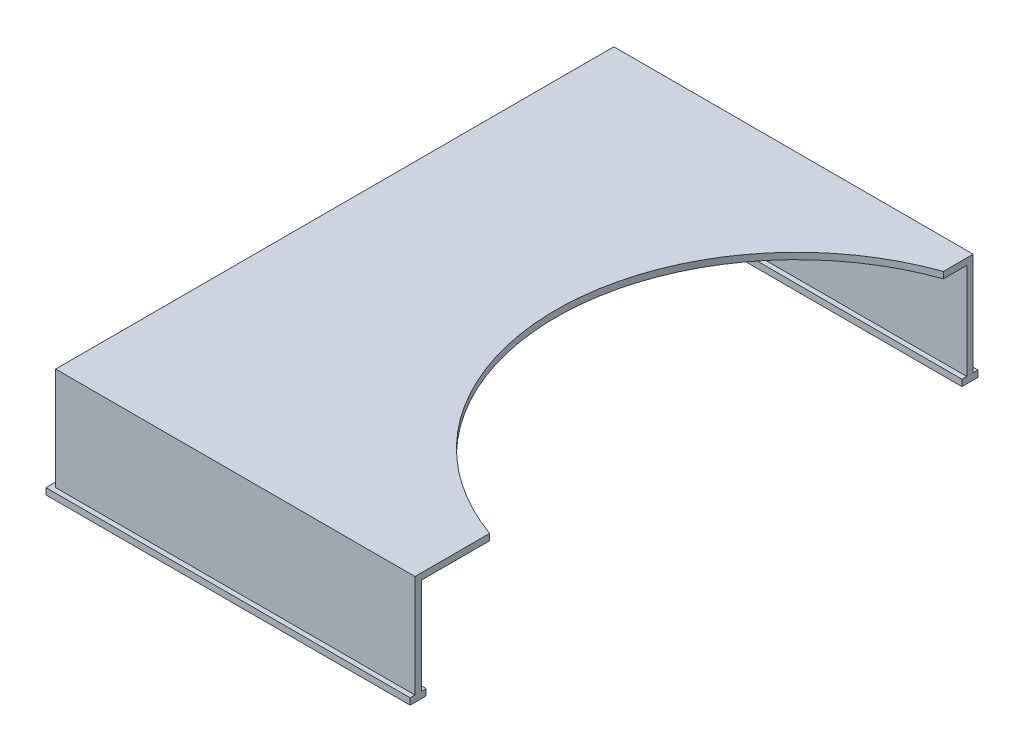
from build123d import *

# Parameters (mm, degrees)
SKETCH_1_W          = 224
SKETCH_1_H          = 174
SKETCH_1_W_2        = 220
SKETCH_1_H_2        = 170
EXTRUDE_1_DEPTH     = 32
SKETCH_2_W          = 227
SKETCH_2_H          = 177
SKETCH_2_W_2        = 217
SKETCH_2_H_2        = 167
EXTRUDE_2_DEPTH     = 2
SKETCH_3_W          = 222
SKETCH_3_H          = 172
SKETCH_3_R          = 75
EXTRUDE_3_DEPTH     = 2
SKETCH_4_W          = 113.5
SKETCH_4_H          = 177
CUT_EXTRUDE_1_DEPTH = 285.974560268


with BuildPart() as part:
    # 草图1 → 凸台-拉伸1 (new body)
    with BuildSketch(Plane(origin=(0, 0, 0), x_dir=(1, 0, 0), z_dir=(0, 1, 0))):
        with Locations((110, -85)):
            Rectangle(SKETCH_1_W, SKETCH_1_H)
        with Locations((110, -85)):
            Rectangle(SKETCH_1_W_2, SKETCH_1_H_2, mode=Mode.SUBTRACT)
    extrude(amount=EXTRUDE_1_DEPTH)

    # 草图2 → 凸台-拉伸2 (add)
    with BuildSketch(Plane(origin=(0, 0, 0), x_dir=(1, 0, 0), z_dir=(0, 1, 0))):
        with Locations((110, -85)):
            Rectangle(SKETCH_2_W, SKETCH_2_H)
        with Locations((110, -85)):
            Rectangle(SKETCH_2_W_2, SKETCH_2_H_2, mode=Mode.SUBTRACT)
    extrude(amount=-EXTRUDE_2_DEPTH)

    # 草图3 → 凸台-拉伸3 (add)
    with BuildSketch(Plane(origin=(0, 32, 0), x_dir=(1, 0, 0), z_dir=(0, 1, 0))):
        with Locations((109, -84)):
            Rectangle(SKETCH_3_W, SKETCH_3_H)
        with Locations(Location((135, -78, 0), (0, 0, 270))):
            Circle(SKETCH_3_R, mode=Mode.SUBTRACT)
    extrude(amount=-EXTRUDE_3_DEPTH)

    # 草图4 → 切除-拉伸1 (cut, through all)
    with BuildSketch(Plane(origin=(0, 32, 0), x_dir=(1, 0, 0), z_dir=(0, 1, 0))):
        with Locations((166.75, -85)):
            Rectangle(SKETCH_4_W, SKETCH_4_H)
    extrude(amount=-CUT_EXTRUDE_1_DEPTH, mode=Mode.SUBTRACT)


solid = part.part
